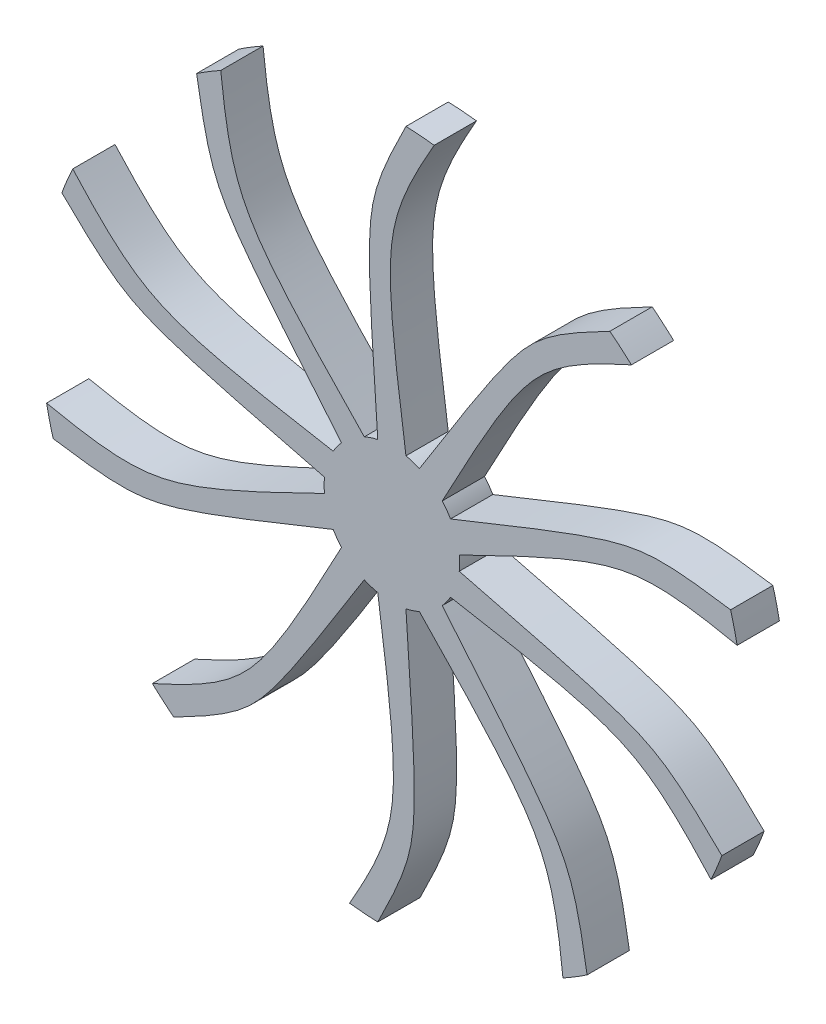
from build123d import *

# Parameters (mm, degrees)
BOSS_EXTRUDE3_DEPTH = 30


with BuildPart() as part:
    # Sketch1 → Boss-Extrude3 (new body)
    with BuildSketch(Plane.XY):
        with BuildLine():
            ThreePointArc((-10, 47.018073759), (-14.854364506, 45.717033096), (-19.546360403, 43.916273236))
            add(Edge.make_bspline(
                [(-19.546360403, 43.916273236), (-113.09637125, 140.200566945), (-121.402656368, 218.135469823)],
                knots=[0, 0, 0, 1, 1, 1], degree=2, weights=[1, 2.333333333, 1]))
            ThreePointArc((-121.402656368, 218.135469823), (-130.070701563, 213.080503011), (-138.528602909, 207.681280679))
            add(Edge.make_bspline(
                [(-35.72670029, 32.160568191), (-127.721013505, 141.647594866), (-138.528602909, 207.681280679)],
                knots=[0, 0, 0, 1, 1, 1], degree=2, weights=[1, 3, 1]))
            ThreePointArc((-35.72670029, 32.160568191), (-38.889231158, 28.254680318), (-41.626675488, 24.039948997))
            add(Edge.make_bspline(
                [(-41.626675488, 24.039948997), (-173.904711956, 46.948262171), (-226.433624328, 105.116611161)],
                knots=[0, 0, 0, 1, 1, 1], degree=2, weights=[1, 2.333333333, 1]))
            ThreePointArc((-226.433624328, 105.116611161), (-230.474985255, 95.932107972), (-234.14398792, 86.592615672))
            add(Edge.make_bspline(
                [(-47.807015375, 5.018818671), (-186.586837749, 39.522783313), (-234.14398792, 86.592615672)],
                knots=[0, 0, 0, 1, 1, 1], degree=2, weights=[1, 3, 1]))
            ThreePointArc((-47.807015375, 5.018818671), (-48.069733304, 0), (-47.807015375, -5.018818671))
            add(Edge.make_bspline(
                [(-47.807015375, -5.018818671), (-168.2873635, -64.236683039), (-244.974643991, -48.053220183)],
                knots=[0, 0, 0, 1, 1, 1], degree=2, weights=[1, 2.333333333, 1]))
            ThreePointArc((-244.974643991, -48.053220183), (-242.845658137, -57.8590917), (-240.324327808, -67.571485346))
            add(Edge.make_bspline(
                [(-41.626675488, -24.039948997), (-174.182831827, -77.698388136), (-240.324327808, -67.571485346)],
                knots=[0, 0, 0, 1, 1, 1], degree=2, weights=[1, 3, 1]))
            ThreePointArc((-41.626675488, -24.039948997), (-38.889231158, -28.254680318), (-35.72670029, -32.160568191))
            add(Edge.make_bspline(
                [(-35.72670029, -32.160568191), (-98.389962063, -150.885398653), (-169.943676031, -182.868354686)],
                knots=[0, 0, 0, 1, 1, 1], degree=2, weights=[1, 2.333333333, 1]))
            ThreePointArc((-169.943676031, -182.868354686), (-162.457543631, -189.5500849), (-154.708942796, -195.925575633))
            add(Edge.make_bspline(
                [(-19.546360403, -43.916273236), (-95.246904403, -165.241416188), (-154.708942796, -195.925575633)],
                knots=[0, 0, 0, 1, 1, 1], degree=2, weights=[1, 3, 1]))
            ThreePointArc((-19.546360403, -43.916273236), (-14.854364506, -45.717033096), (-10, -47.018073759))
            add(Edge.make_bspline(
                [(-10, -47.018073759), (9.08906073, -179.901020388), (-30, -247.833993165)],
                knots=[0, 0, 0, 1, 1, 1], degree=2, weights=[1, 2.333333333, 1]))
            ThreePointArc((-30, -247.833993165), (-20.016169186, -248.839388239), (-10, -249.442755293))
            add(Edge.make_bspline(
                [(10, -47.018073759), (20.070103179, -189.667839605), (-10, -249.442755293)],
                knots=[0, 0, 0, 1, 1, 1], degree=2, weights=[1, 3, 1]))
            ThreePointArc((10, -47.018073759), (14.854364506, -45.717033096), (19.546360403, -43.916273236))
            add(Edge.make_bspline(
                [(19.546360403, -43.916273236), (113.09637125, -140.200566945), (121.402656368, -218.135469823)],
                knots=[0, 0, 0, 1, 1, 1], degree=2, weights=[1, 2.333333333, 1]))
            ThreePointArc((121.402656368, -218.135469823), (130.070701563, -213.080503011), (138.528602909, -207.681280679))
            add(Edge.make_bspline(
                [(35.72670029, -32.160568191), (127.721013505, -141.647594866), (138.528602909, -207.681280679)],
                knots=[0, 0, 0, 1, 1, 1], degree=2, weights=[1, 3, 1]))
            ThreePointArc((35.72670029, -32.160568191), (38.889231158, -28.254680318), (41.626675488, -24.039948997))
            add(Edge.make_bspline(
                [(41.626675488, -24.039948997), (173.904711956, -46.948262171), (226.433624328, -105.116611161)],
                knots=[0, 0, 0, 1, 1, 1], degree=2, weights=[1, 2.333333333, 1]))
            ThreePointArc((226.433624328, -105.116611161), (230.474985255, -95.932107972), (234.14398792, -86.592615672))
            add(Edge.make_bspline(
                [(47.807015375, -5.018818671), (186.586837749, -39.522783313), (234.14398792, -86.592615672)],
                knots=[0, 0, 0, 1, 1, 1], degree=2, weights=[1, 3, 1]))
            ThreePointArc((47.807015375, -5.018818671), (48.069733304, 0), (47.807015375, 5.018818671))
            add(Edge.make_bspline(
                [(47.807015375, 5.018818671), (168.2873635, 64.236683039), (244.974643991, 48.053220183)],
                knots=[0, 0, 0, 1, 1, 1], degree=2, weights=[1, 2.333333333, 1]))
            ThreePointArc((244.974643991, 48.053220183), (242.845658137, 57.8590917), (240.324327808, 67.571485346))
            add(Edge.make_bspline(
                [(41.626675488, 24.039948997), (174.182831827, 77.698388136), (240.324327808, 67.571485346)],
                knots=[0, 0, 0, 1, 1, 1], degree=2, weights=[1, 3, 1]))
            ThreePointArc((41.626675488, 24.039948997), (38.889231158, 28.254680318), (35.72670029, 32.160568191))
            add(Edge.make_bspline(
                [(35.72670029, 32.160568191), (98.389962063, 150.885398653), (169.943676031, 182.868354686)],
                knots=[0, 0, 0, 1, 1, 1], degree=2, weights=[1, 2.333333333, 1]))
            ThreePointArc((169.943676031, 182.868354686), (162.457543631, 189.5500849), (154.708942796, 195.925575633))
            add(Edge.make_bspline(
                [(19.546360403, 43.916273236), (95.246904403, 165.241416188), (154.708942796, 195.925575633)],
                knots=[0, 0, 0, 1, 1, 1], degree=2, weights=[1, 3, 1]))
            ThreePointArc((19.546360403, 43.916273236), (14.854364506, 45.717033096), (10, 47.018073759))
            add(Edge.make_bspline(
                [(10, 47.018073759), (-9.08906073, 179.901020388), (30, 247.833993165)],
                knots=[0, 0, 0, 1, 1, 1], degree=2, weights=[1, 2.333333333, 1]))
            ThreePointArc((30, 247.833993165), (20.016169186, 248.839388239), (10, 249.442755293))
            add(Edge.make_bspline(
                [(-10, 47.018073759), (-20.070103179, 189.667839605), (10, 249.442755293)],
                knots=[0, 0, 0, 1, 1, 1], degree=2, weights=[1, 3, 1]))
        make_face()
    extrude(amount=BOSS_EXTRUDE3_DEPTH)


solid = part.part
